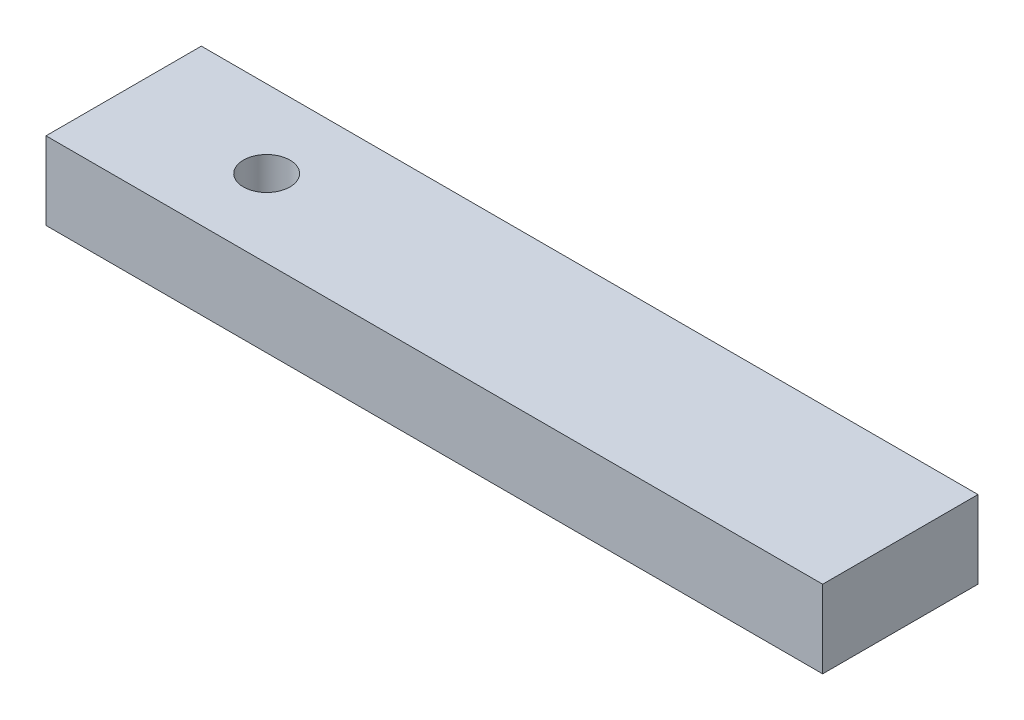
from build123d import *

# Parameters (mm, degrees)
IZIM1_W                     = 100
IZIM1_H                     = 20
Y_KSEKLIK_EKSTR_ZYON1_DEPTH = 10
IZIM2_R                     = 3
KES_EKSTR_ZYON1_DEPTH       = 52.961524227


with BuildPart() as part:
    # Çizim1 → Yükseklik-Ekstrüzyon1 (new body)
    with BuildSketch(Plane(origin=(0, 0, 0), x_dir=(1, 0, 0), z_dir=(0, 1, 0))):
        Rectangle(IZIM1_W, IZIM1_H)
    extrude(amount=Y_KSEKLIK_EKSTR_ZYON1_DEPTH)

    # Çizim2 → Kes-Ekstrüzyon1 (cut, through all)
    with BuildSketch(Plane(origin=(0, 10, 0), x_dir=(1, 0, 0), z_dir=(0, 1, 0))):
        with Locations(Location((-31.589166648, 0, 0), (0, 0, 270))):
            Circle(IZIM2_R)
    extrude(amount=-KES_EKSTR_ZYON1_DEPTH, mode=Mode.SUBTRACT)


solid = part.part
